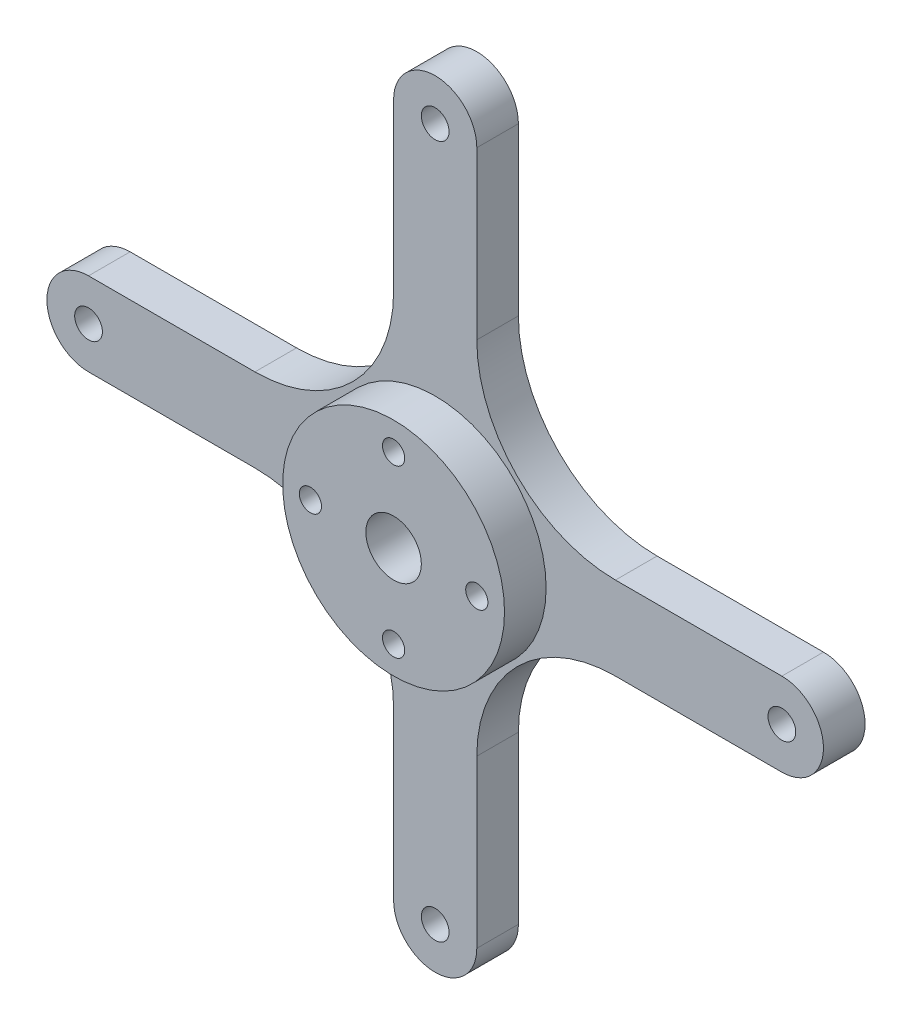
from build123d import *

# Parameters (mm, degrees)
SKETCH1_R           = 0.8
BOSS_EXTRUDE1_DEPTH = 3
FILLET1_R           = 10
SKETCH2_R           = 2
CUT_EXTRUDE1_DEPTH  = 3
SKETCH3_R           = 8
SKETCH3_R_2         = 2
SKETCH3_R_3         = 0.8
BOSS_EXTRUDE2_DEPTH = 3
SKETCH4_R           = 1
CUT_EXTRUDE2_DEPTH  = 3


with BuildPart() as part:
    # Sketch1 → Boss-Extrude1 (new body)
    # profile 1 of 2: a face of its own
    with BuildSketch(Plane.XY):
        with BuildLine():
            Line((25, -3), (-25, -3))
            ThreePointArc((-25, -3), (-28, 0), (-25, 3))
            Line((-25, 3), (25, 3))
            ThreePointArc((25, 3), (28, 0), (25, -3))
        make_face()
        with Locations((-6, 0)):
            Circle(SKETCH1_R, mode=Mode.SUBTRACT)
        with Locations((6, 0)):
            Circle(SKETCH1_R, mode=Mode.SUBTRACT)
    # profile 2 of 2: a face of its own
    with BuildSketch(Plane.XY):
        with BuildLine():
            Line((-3, -25), (-3, 25))
            ThreePointArc((-3, 25), (0, 28), (3, 25))
            Line((3, 25), (3, -25))
            ThreePointArc((3, -25), (0, -28), (-3, -25))
        make_face()
        with Locations((0, 6)):
            Circle(SKETCH1_R, mode=Mode.SUBTRACT)
        with Locations((0, -6)):
            Circle(SKETCH1_R, mode=Mode.SUBTRACT)
    extrude(amount=BOSS_EXTRUDE1_DEPTH)

    # Fillet1
    fillet1_edges = [part.edges().sort_by_distance(p)[0] for p in [
        (3, -3, 1.5),
        (-3, -3, 1.5),
        (-3, 3, 1.5),
        (3, 3, 1.5),
    ]]
    fillet(fillet1_edges, radius=FILLET1_R)

    # Sketch2 → Cut-Extrude1 (cut)
    with BuildSketch(Plane.XY.offset(3)):
        Circle(SKETCH2_R)
    extrude(amount=-CUT_EXTRUDE1_DEPTH, mode=Mode.SUBTRACT)

    # Sketch3 → Boss-Extrude2 (add)
    with BuildSketch(Plane.XY.offset(3)):
        Circle(SKETCH3_R)
        Circle(SKETCH3_R_2, mode=Mode.SUBTRACT)
        with Locations((0, 6)):
            Circle(SKETCH3_R_3, mode=Mode.SUBTRACT)
        with Locations((6, 0)):
            Circle(SKETCH3_R_3, mode=Mode.SUBTRACT)
        with Locations((0, -6)):
            Circle(SKETCH3_R_3, mode=Mode.SUBTRACT)
        with Locations((-6, 0)):
            Circle(SKETCH3_R_3, mode=Mode.SUBTRACT)
    extrude(amount=BOSS_EXTRUDE2_DEPTH)

    # Sketch4 → Cut-Extrude2 (cut)
    with BuildSketch(Plane.XY.offset(3)):
        with Locations((0, 25)):
            Circle(SKETCH4_R)
        with Locations((25, 0)):
            Circle(SKETCH4_R)
        with Locations((0, -25)):
            Circle(SKETCH4_R)
        with Locations((-25, 0)):
            Circle(SKETCH4_R)
    extrude(amount=-CUT_EXTRUDE2_DEPTH, mode=Mode.SUBTRACT)


solid = part.part
